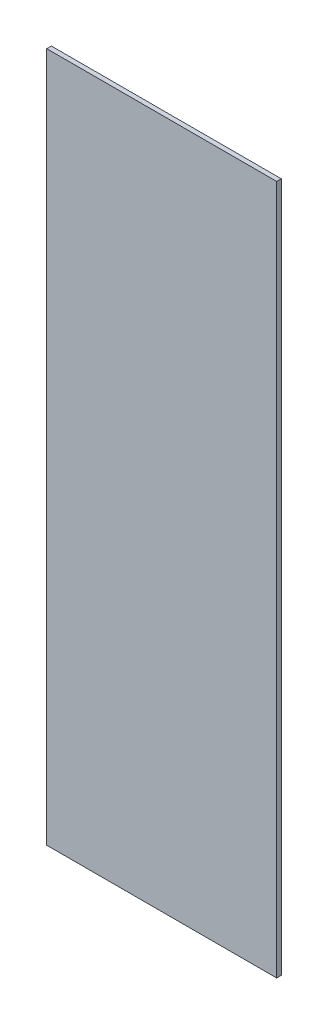
from build123d import *

# Parameters (mm, degrees)
SKETCH1_W           = 100
SKETCH1_H           = 300
BOSS_EXTRUDE1_DEPTH = 2


with BuildPart() as part:
    # Sketch1 → Boss-Extrude1 (new body)
    with BuildSketch(Plane.XY):
        with Locations((50, -150)):
            Rectangle(SKETCH1_W, SKETCH1_H)
    extrude(amount=BOSS_EXTRUDE1_DEPTH)


solid = part.part
